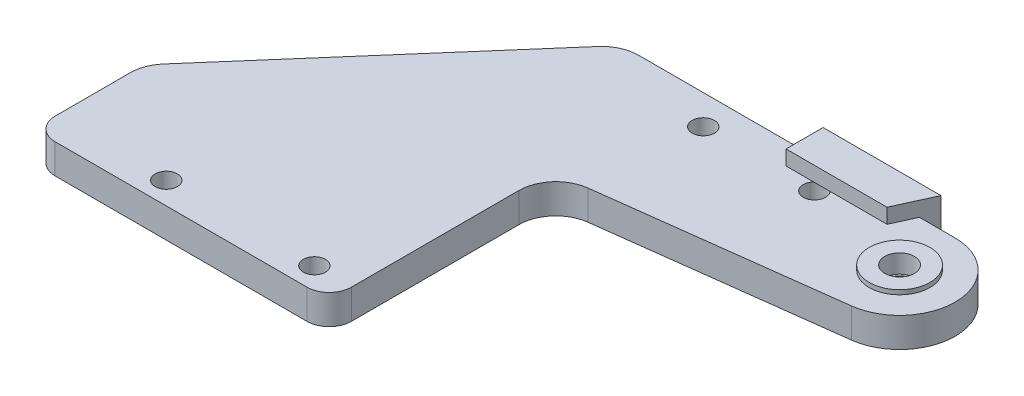
from build123d import *
from OCP.BRepFilletAPI import BRepFilletAPI_MakeFillet

# Parameters (mm, degrees)
SKETCH_1_R             = 3.5
SKETCH_1_R_2           = 1.5
EXTRUDE_1_DEPTH        = 4
FILLET_1_R1            = 5
FILLET_1_R2            = 3
EXTRUDE_2_DEPTH        = 2
PATTERN_LINEAR_1_COUNT = 2
PATTERN_LINEAR_1_PITCH = 6
EXTRUDE_4_DEPTH        = 4


with BuildPart() as part:
    # 草图1 → 凸台-拉伸1 (new body)
    with BuildSketch(Plane(origin=(0, 0, 0), x_dir=(1, 0, 0), z_dir=(0, 1, 0))):
        with BuildLine():
            Line((0, 0), (40, 0))
            Line((40, 0), (40, 30))
            Line((40, 30), (75.943842427, 34.559626254))
            ThreePointArc((75.943842427, 34.559626254), (82.485078593, 42.472861982), (75, 49.5))
            Line((75, 49.5), (30, 49.5))
            Line((30, 49.5), (0, 15))
            Line((0, 15), (0, 0))
        make_face()
        with Locations(Location((75, 42, 0), (0, 0, 270))):
            Circle(SKETCH_1_R, mode=Mode.SUBTRACT)
        with Locations(Location((15, 3, 0), (0, 0, 270))):
            Circle(SKETCH_1_R_2, mode=Mode.SUBTRACT)
        with Locations(Location((35, 3, 0), (0, 0, 270))):
            Circle(SKETCH_1_R_2, mode=Mode.SUBTRACT)
        with Locations(Location((45, 45.5, 0), (0, 0, 270))):
            Circle(SKETCH_1_R_2, mode=Mode.SUBTRACT)
        with Locations(Location((60, 45.5, 0), (0, 0, 270))):
            Circle(SKETCH_1_R_2, mode=Mode.SUBTRACT)
    extrude(amount=EXTRUDE_1_DEPTH)

    # 圆角1: one fillet with a radius per group of edges: ONE call of the kernel's fillet builder (fillet() takes one radius for all edges)
    fillet_1_edges_1 = [part.edges().sort_by_distance(p)[0] for p in [
        (40, 2, -30),
        (30, 2, -49.5),
        (0, 2, -15),
    ]]
    fillet_1_edges_2 = [part.edges().sort_by_distance(p)[0] for p in [
        (40, 2, 0),
        (0, 2, 0),
    ]]
    fillet_1 = BRepFilletAPI_MakeFillet(part.part.solid().wrapped)
    for e in fillet_1_edges_1:
        fillet_1.Add(FILLET_1_R1, e.wrapped)
    for e in fillet_1_edges_2:
        fillet_1.Add(FILLET_1_R2, e.wrapped)
    add(Compound.cast(fillet_1.Shape()), mode=Mode.REPLACE)


with BuildPart() as body_2:
    # 草图2 → 旋转1 (revolve)
    with BuildSketch(Plane.ZY.offset(-75), mode=Mode.PRIVATE) as revolve_1_sk:
        Polygon((-38.5, 0), (-38.5, 1.9), (-40, 1.9), (-40, -0.6), (-37.9, -0.6), (-37.9, 0), align=None)
        Polygon((-38.5, 2.1), (-40, 2.1), (-40, 4.6), (-37.9, 4.6), (-37.9, 4), (-38.5, 4), align=None)
    revolve(revolve_1_sk.sketch.rotate(Axis((75, 0, -42), (0, 1, 0)), 180), axis=Axis((75, 0, -42), (0, 1, 0)))


with BuildPart() as body_3:
    # 草图3 → 凸台-拉伸2 (new body)
    with BuildSketch(Plane(origin=(0, 4, 0), x_dir=(1, 0, 0), z_dir=(0, 1, 0))):
        Polygon((71.087290406, 51.5), (68.808659128, 46.5), (55.175837895, 46.5), (55.175837895, 51.5), align=None)
    extrude_2 = extrude(amount=EXTRUDE_2_DEPTH)



with BuildPart() as pattern_linear_1_1:
    # 阵列(线性)1: 凸台-拉伸2 ×2
    with Locations(*[(0, -i * PATTERN_LINEAR_1_PITCH, 0) for i in range(1, PATTERN_LINEAR_1_COUNT)]):
        add(extrude_2)


with BuildPart() as body_3_1:
    add(body_3.part)

    add(pattern_linear_1_1.part)  # 凸台-拉伸4 merges 阵列(线性)1_1
    # 草图5 → 凸台-拉伸4 (add)
    with BuildSketch(Plane(origin=(0, 0, 0), x_dir=(1, 0, 0), z_dir=(0, 1, 0))):
        Polygon((55.175837895, 51.5), (55.175837895, 49.5), (70.175837895, 49.5), (71.087290406, 51.5), align=None)
    extrude(amount=EXTRUDE_4_DEPTH)


solid = Compound([part.part, body_2.part, body_3_1.part])
